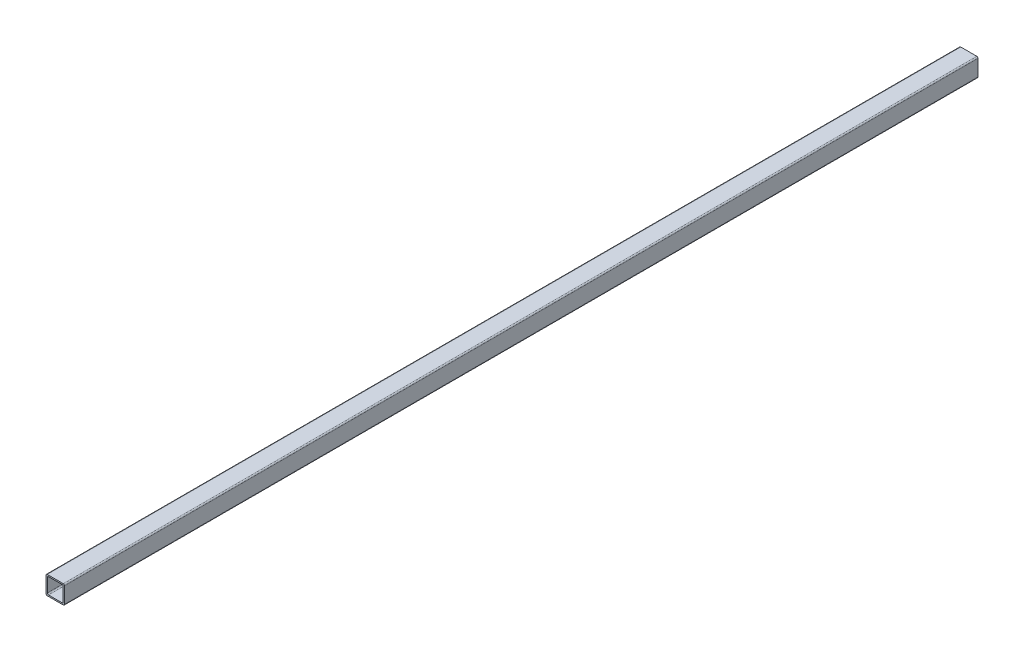
from build123d import *

# Parameters (mm, degrees)
BOSS_EXTRUDE1_DEPTH = 1880


with BuildPart() as part:
    # Sketch1 → Boss-Extrude1 (new body)
    with BuildSketch(Plane.XY):
        with BuildLine():
            Line((2.54, 0), (35.56, 0))
            ThreePointArc((35.56, 0), (37.356051224, -0.743948776), (38.1, -2.54))
            Line((38.1, -2.54), (38.1, -35.56))
            ThreePointArc((38.1, -35.56), (37.356051224, -37.356051224), (35.56, -38.1))
            Line((35.56, -38.1), (2.54, -38.1))
            ThreePointArc((2.54, -38.1), (0.743948776, -37.356051224), (0, -35.56))
            Line((0, -35.56), (0, -2.54))
            ThreePointArc((0, -2.54), (0.743948776, -0.743948776), (2.54, 0))
        make_face()
        with BuildLine():
            Line((5.3086, -2.7686), (32.7914, -2.7686))
            ThreePointArc((32.7914, -2.7686), (34.587451224, -3.512548776), (35.3314, -5.3086))
            Line((35.3314, -5.3086), (35.3314, -32.7914))
            ThreePointArc((35.3314, -32.7914), (34.587451224, -34.587451224), (32.7914, -35.3314))
            Line((32.7914, -35.3314), (5.3086, -35.3314))
            ThreePointArc((5.3086, -35.3314), (3.512548776, -34.587451224), (2.7686, -32.7914))
            Line((2.7686, -32.7914), (2.7686, -5.3086))
            ThreePointArc((2.7686, -5.3086), (3.512548776, -3.512548776), (5.3086, -2.7686))
        make_face(mode=Mode.SUBTRACT)
    extrude(amount=BOSS_EXTRUDE1_DEPTH)


solid = part.part
